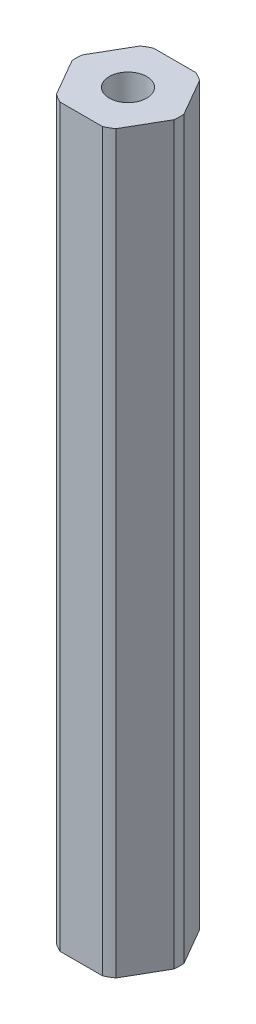
from build123d import *

# Parameters (mm, degrees)
SKETCH1_R           = 2.5527
BOSS_EXTRUDE1_DEPTH = 50.00625


with BuildPart() as part:
    # Sketch1 → Boss-Extrude1 (new, symmetric)
    with BuildSketch(Plane(origin=(0, 0, 0), x_dir=(1, 0, 0), z_dir=(0, 1, 0))):
        with BuildLine():
            ThreePointArc((2.89465988, -6.35), (3.489325, -6.043688184), (4.051931374, -5.681848992))
            Line((4.051931374, -5.681848992), (6.946591254, -0.668151008))
            ThreePointArc((6.946591254, -0.668151008), (6.970630706, -0.334459838), (6.97865, 0))
            ThreePointArc((6.97865, 0), (6.970630706, 0.334459838), (6.946591254, 0.668151008))
            Line((6.946591254, 0.668151008), (4.051931374, 5.681848992))
            ThreePointArc((4.051931374, 5.681848992), (3.489325, 6.043688184), (2.89465988, 6.35))
            Line((2.89465988, 6.35), (-2.89465988, 6.35))
            ThreePointArc((-2.89465988, 6.35), (-3.489325, 6.043688184), (-4.051931374, 5.681848992))
            Line((-4.051931374, 5.681848992), (-6.946591254, 0.668151008))
            ThreePointArc((-6.946591254, 0.668151008), (-6.97865, 0), (-6.946591254, -0.668151008))
            Line((-6.946591254, -0.668151008), (-4.051931374, -5.681848992))
            ThreePointArc((-4.051931374, -5.681848992), (-3.489325, -6.043688184), (-2.89465988, -6.35))
            Line((-2.89465988, -6.35), (2.89465988, -6.35))
        make_face()
        with Locations(Location((0, 0, 0), (0, 0, 90))):
            Circle(SKETCH1_R, mode=Mode.SUBTRACT)
    extrude(amount=BOSS_EXTRUDE1_DEPTH, both=True)


solid = part.part
